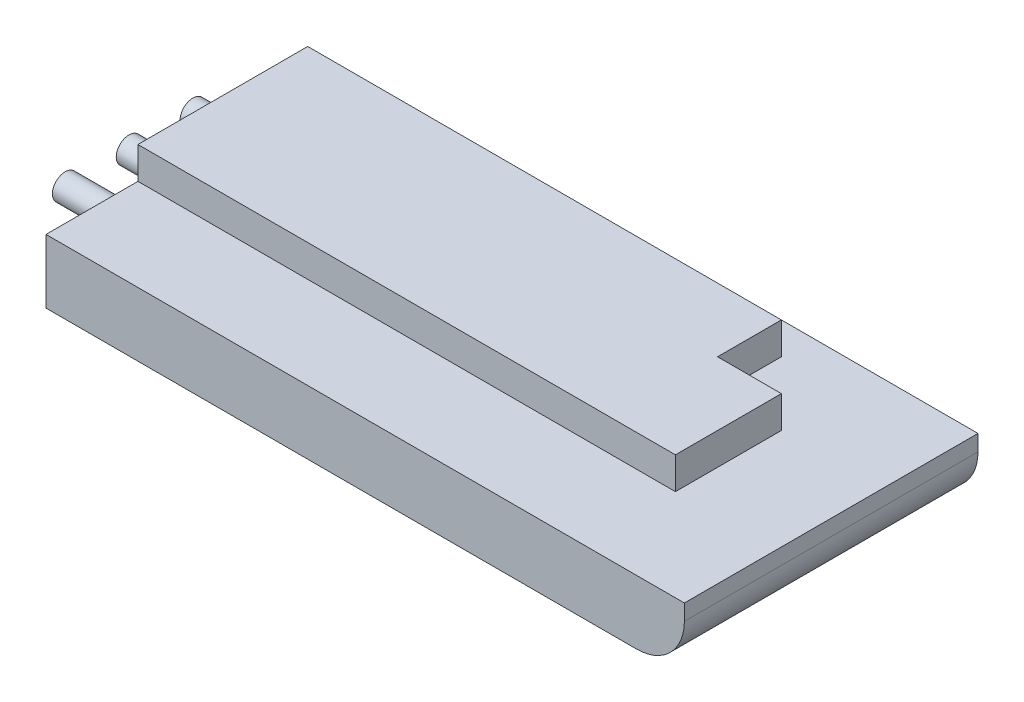
from build123d import *

# Parameters (mm, degrees)
SKETCH1_W           = 254
SKETCH1_H           = 58.42
BOSS_EXTRUDE1_DEPTH = 19.05
CUT_EXTRUDE1_DEPTH  = 6.35
FILLET1_R           = 9.525
CUT_EXTRUDE2_START  = -127
SKETCH3_W           = 65.063506332
SKETCH3_H           = 25.722431086
CUT_EXTRUDE2_DEPTH  = 127
SKETCH4_R           = 2.54
BOSS_EXTRUDE2_DEPTH = 12.7
SKETCH5_W           = 12.7
SKETCH5_H           = 21.082
BOSS_EXTRUDE3_DEPTH = 6.35


with BuildPart() as part:
    # Sketch1 → Boss-Extrude1 (new body)
    with BuildSketch(Plane(origin=(0, 0, 0), x_dir=(1, 0, 0), z_dir=(0, 1, 0))):
        with Locations((127, 29.21)):
            Rectangle(SKETCH1_W, SKETCH1_H)
    extrude(amount=BOSS_EXTRUDE1_DEPTH)

    # Sketch2 → Cut-Extrude1 (cut)
    with BuildSketch(Plane(origin=(0, 19.05, 0), x_dir=(1, 0, 0), z_dir=(0, 1, 0))):
        Polygon((221.234, 52.07), (221.234, 18.288), (127, 18.288), (127, 0), (254, 0), (254, 58.42), (127, 58.42), (127, 52.07), align=None)
        Polygon((127, 0), (127, 18.288), (32.766, 18.288), (32.766, 52.07), (127, 52.07), (127, 58.42), (0, 58.42), (0, 0), align=None)
    extrude(amount=-CUT_EXTRUDE1_DEPTH, mode=Mode.SUBTRACT)

    # Fillet1
    fillet1_edges = [part.edges().sort_by_distance(p)[0] for p in [
        (254, 0, -29.21),
        (0, 0, -29.21),
    ]]
    fillet(fillet1_edges, radius=FILLET1_R)

    # Sketch3 → Cut-Extrude2 (cut)
    with BuildSketch(Plane.ZY.offset(CUT_EXTRUDE2_START)):
        with Locations((-32.531753166, 12.861215543)):
            Rectangle(SKETCH3_W, SKETCH3_H)
    extrude(amount=CUT_EXTRUDE2_DEPTH, mode=Mode.SUBTRACT)

    # Sketch4 → Boss-Extrude2 (add)
    with BuildSketch(Plane.ZY.offset(-127)):
        with Locations((-16.51, 6.35)):
            Circle(SKETCH4_R)
        with Locations((-29.21, 6.35)):
            Circle(SKETCH4_R)
        with Locations((-41.91, 6.35)):
            Circle(SKETCH4_R)
    extrude(amount=BOSS_EXTRUDE2_DEPTH)

    # Sketch5 → Boss-Extrude3 (add)
    with BuildSketch(Plane(origin=(0, 12.7, 0), x_dir=(1, 0, 0), z_dir=(0, 1, 0))):
        with Locations((227.584, 28.829)):
            Rectangle(SKETCH5_W, SKETCH5_H)
    extrude(amount=BOSS_EXTRUDE3_DEPTH)


solid = part.part
